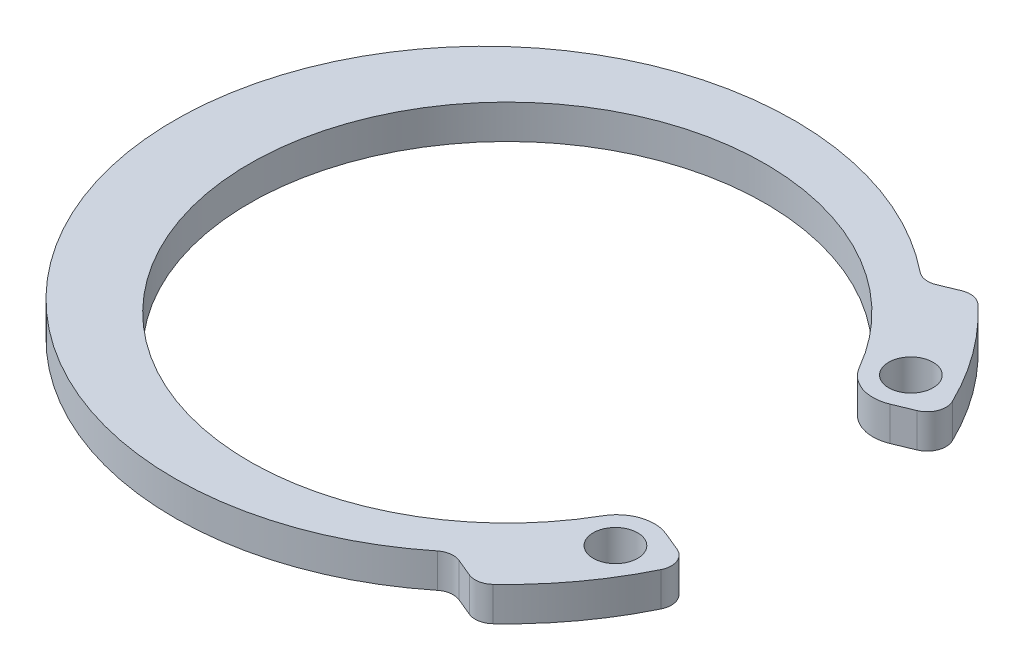
from build123d import *

# Parameters (mm, degrees)
BOSS_EXTRUDE1_DEPTH      = 0.5
BOSS_EXTRUDE1_DEPTH_BACK = 0.5
SKETCH3_R                = 0.65


with BuildPart() as part:
    # Sketch3 → Boss-Extrude1 (new, two sides: drawn at the far end of the back side and taken through both)
    with BuildSketch(Plane(origin=(0, 0, 0), x_dir=(1, 0, 0), z_dir=(0, 1, 0)).offset(-BOSS_EXTRUDE1_DEPTH_BACK)):
        with BuildLine():
            Line((5.573175036, 6.989830952), (6.096093397, 7.206430829))
            ThreePointArc((6.096093397, 7.206430829), (6.405735278, 7.23928332), (6.683592449, 7.09873876))
            ThreePointArc((6.683592449, 7.09873876), (7.855147596, 5.775738589), (8.768655543, 4.263001286))
            ThreePointArc((8.768655543, 4.263001286), (8.788214132, 3.827338113), (8.484489323, 3.514390548))
            Line((8.484489323, 3.514390548), (7.926676414, 3.283336875))
            ThreePointArc((7.926676414, 3.283336875), (7.150377852, 3.258581469), (6.551239424, 3.752833864))
            ThreePointArc((6.551239424, 3.752833864), (-7.55, 0), (6.551239424, -3.752833864))
            ThreePointArc((6.551239424, -3.752833864), (7.150377852, -3.258581469), (7.926676414, -3.283336875))
            Line((7.926676414, -3.283336875), (8.484489323, -3.514390548))
            ThreePointArc((8.484489323, -3.514390548), (8.788214132, -3.827338113), (8.768655543, -4.263001286))
            ThreePointArc((8.768655543, -4.263001286), (7.855147596, -5.775738589), (6.683592449, -7.09873876))
            ThreePointArc((6.683592449, -7.09873876), (6.405735278, -7.23928332), (6.096093397, -7.206430829))
            Line((6.096093397, -7.206430829), (5.573175036, -6.989830952))
            ThreePointArc((5.573175036, -6.989830952), (5.284548966, -6.953545234), (5.017784709, -7.069555976))
            ThreePointArc((5.017784709, -7.069555976), (-9.75, 0), (5.017784709, 7.069555976))
            ThreePointArc((5.017784709, 7.069555976), (5.284548966, 6.953545234), (5.573175036, 6.989830952))
        make_face()
        with Locations(Location((7.491119743, -4.325, 0), (0, 0, 270))):
            Circle(SKETCH3_R, mode=Mode.SUBTRACT)
        with Locations(Location((7.491119743, 4.325, 0), (0, 0, 270))):
            Circle(SKETCH3_R, mode=Mode.SUBTRACT)
    extrude(amount=BOSS_EXTRUDE1_DEPTH + BOSS_EXTRUDE1_DEPTH_BACK)


solid = part.part
